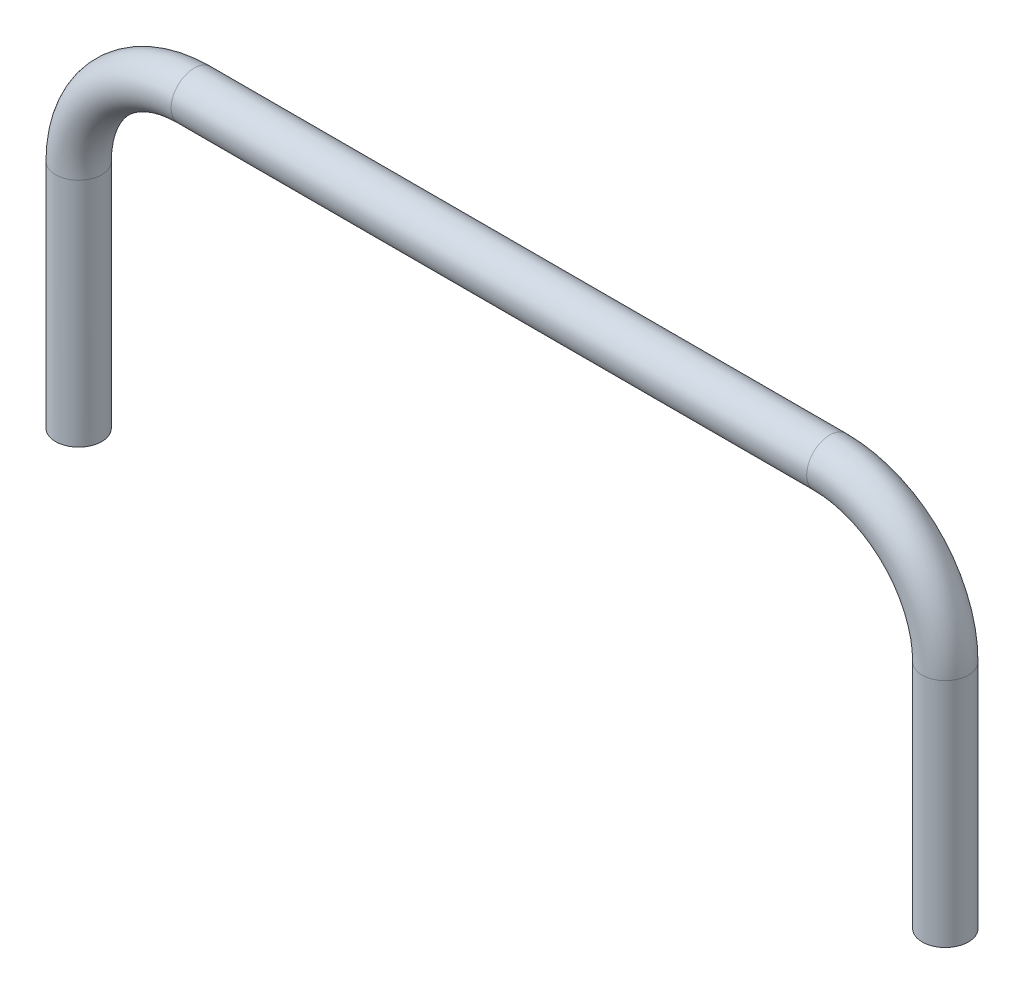
from build123d import *

# Parameters (mm, degrees)
SWEEP1_PROFILE_R = 4


with BuildPart() as part:
    # Sweep1: sweep along a path in Sketch1
    with BuildLine(Plane.XY) as sweep1_path:
        Line((-75, 0), (-75, 40))
        ThreePointArc((-75, 40), (-69.142135624, 54.142135624), (-55, 60))
        Line((-55, 60), (55, 60))
        ThreePointArc((55, 60), (69.142135624, 54.142135624), (75, 40))
        Line((75, 40), (75, 0))
    # Sweep1 profile (on start of the path) → Sweep1 (sweep)
    with BuildSketch(Plane(origin=(-75, 0, 0), x_dir=(1, 0, 0), z_dir=(0, 1, 0))):
        Circle(SWEEP1_PROFILE_R)
    sweep(path=sweep1_path.line)


solid = part.part
